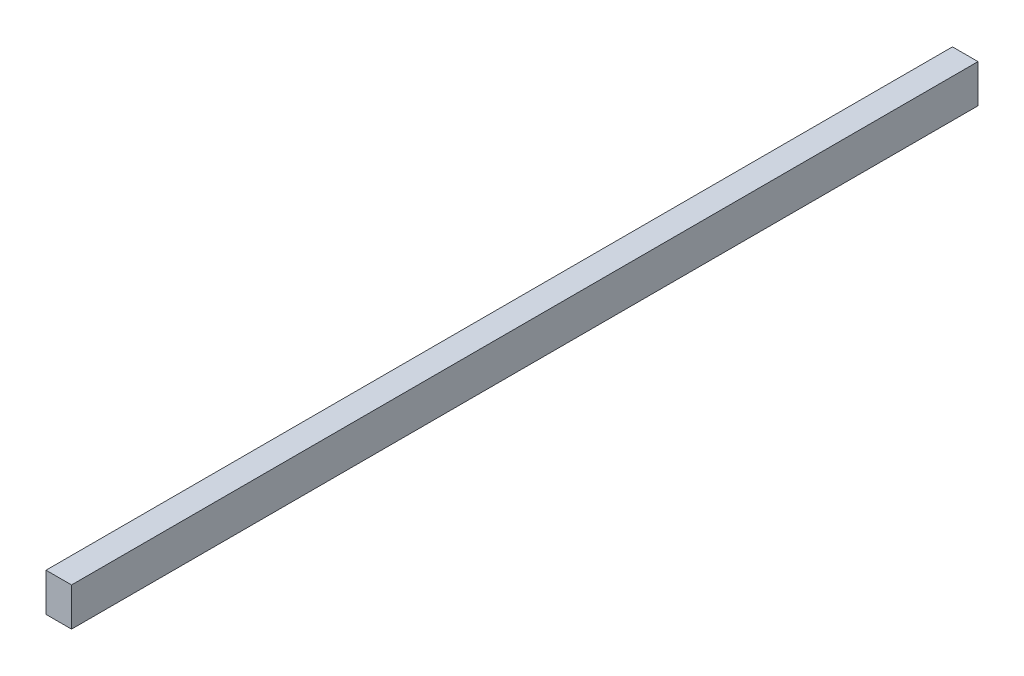
from build123d import *

# Parameters (mm, degrees)
SKETCH1_W           = 426
SKETCH1_H           = 18
BOSS_EXTRUDE1_DEPTH = 12


with BuildPart() as part:
    # Sketch1 → Boss-Extrude1 (new body)
    with BuildSketch(Plane(origin=(0, 0, 0), x_dir=(0, 0, -1), z_dir=(1, 0, 0))):
        with Locations((213, 9)):
            Rectangle(SKETCH1_W, SKETCH1_H)
    extrude(amount=BOSS_EXTRUDE1_DEPTH)


solid = part.part
